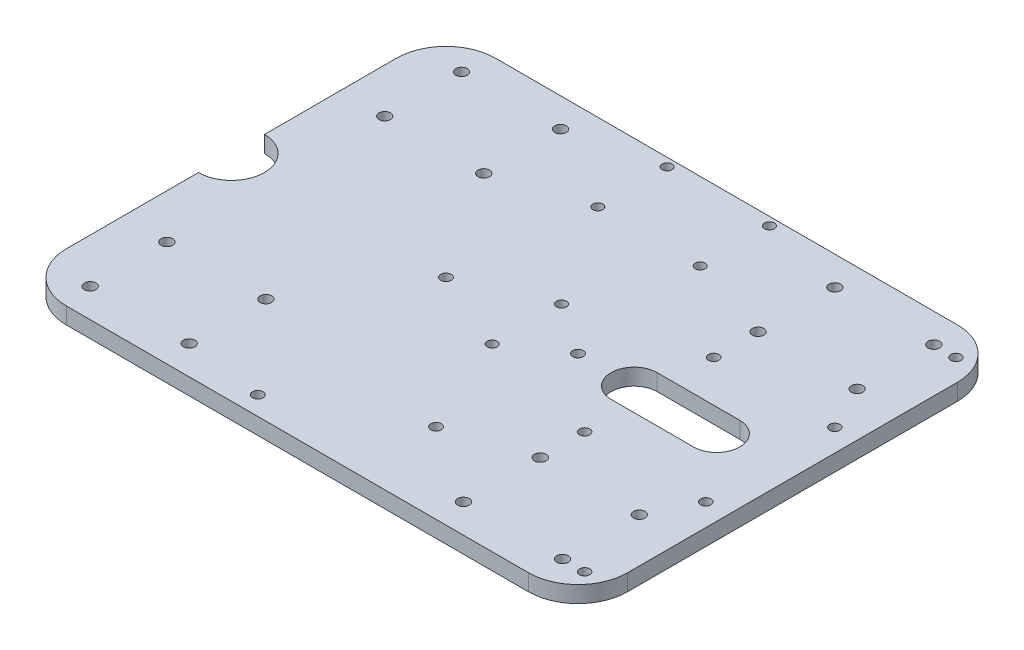
from build123d import *

# Parameters (mm, degrees)
SKETCH1_W           = 170
SKETCH1_H           = 130
BOSS_EXTRUDE1_DEPTH = 5
SKETCH3_R           = 1.75
CUT_EXTRUDE1_DEPTH  = 108.121426428
SKETCH4_R           = 1.55
SKETCH4_R_2         = 1.6
SKETCH4_R_3         = 1.5
CUT_EXTRUDE2_DEPTH  = 108.121426428
CUT_EXTRUDE3_DEPTH  = 108.121426428
CUT_EXTRUDE4_DEPTH  = 108.121426428
FILLET1_R           = 15
SKETCH7_R           = 1.6
CUT_EXTRUDE5_DEPTH  = 10


with BuildPart() as part:
    # Sketch1 → Boss-Extrude1 (new body)
    with BuildSketch(Plane(origin=(0, 0, 0), x_dir=(1, 0, 0), z_dir=(0, 1, 0))):
        Rectangle(SKETCH1_W, SKETCH1_H)
    extrude(amount=BOSS_EXTRUDE1_DEPTH)

    # Sketch3 → Cut-Extrude1 (cut, through all)
    with BuildSketch(Plane(origin=(0, 5, 0), x_dir=(1, 0, 0), z_dir=(0, 1, 0))):
        with Locations((41.55, 56.25)):
            Circle(SKETCH3_R)
        with Locations((71.55, 56.25)):
            Circle(SKETCH3_R)
        with Locations((71.55, 33)):
            Circle(SKETCH3_R)
        with Locations((41.55, 33)):
            Circle(SKETCH3_R)
        with Locations((41.55, -33)):
            Circle(SKETCH3_R)
        with Locations((71.55, -33)):
            Circle(SKETCH3_R)
        with Locations((71.55, -56.25)):
            Circle(SKETCH3_R)
        with Locations((41.55, -56.25)):
            Circle(SKETCH3_R)
        with Locations((-41.55, -56.25)):
            Circle(SKETCH3_R)
        with Locations((-71.55, -56.25)):
            Circle(SKETCH3_R)
        with Locations((-71.55, -33)):
            Circle(SKETCH3_R)
        with Locations((-41.55, -33)):
            Circle(SKETCH3_R)
        with Locations((-41.55, 33)):
            Circle(SKETCH3_R)
        with Locations((-71.55, 33)):
            Circle(SKETCH3_R)
        with Locations((-71.55, 56.25)):
            Circle(SKETCH3_R)
        with Locations((-41.55, 56.25)):
            Circle(SKETCH3_R)
    extrude(amount=-CUT_EXTRUDE1_DEPTH, mode=Mode.SUBTRACT)

    # Sketch4 → Cut-Extrude2 (cut, through all)
    with BuildSketch(Plane.XZ):
        with Locations((78.25, -19.55)):
            Circle(SKETCH4_R)
        with Locations((41.55, -19.55)):
            Circle(SKETCH4_R)
        with Locations((78.25, -56.25)):
            Circle(SKETCH4_R)
        with Locations((78.25, 56.25)):
            Circle(SKETCH4_R)
        with Locations((78.25, 19.55)):
            Circle(SKETCH4_R)
        with Locations((41.55, 19.55)):
            Circle(SKETCH4_R)
        with Locations((-17.7, 59.3)):
            Circle(SKETCH4_R_2)
        with Locations((17.7, 40.7)):
            Circle(SKETCH4_R_2)
        with Locations((4.5, 10.5)):
            Circle(SKETCH4_R_3)
        with Locations((4.5, -10.5)):
            Circle(SKETCH4_R_3)
        with Locations((15.5, -41.5)):
            Circle(SKETCH4_R_3)
        with Locations((15.5, -62.5)):
            Circle(SKETCH4_R_3)
        with Locations((-15.5, -41.5)):
            Circle(SKETCH4_R_3)
        with Locations((-15.5, -62.5)):
            Circle(SKETCH4_R_3)
    extrude(amount=-CUT_EXTRUDE2_DEPTH, mode=Mode.SUBTRACT)

    # Sketch5 → Cut-Extrude3 (cut, through all)
    with BuildSketch(Plane(origin=(0, 5, 0), x_dir=(1, 0, 0), z_dir=(0, 1, 0))):
        with BuildLine():
            Line((62, 7), (37, 7))
            ThreePointArc((37, 7), (30, 0), (37, -7))
            Line((37, -7), (62, -7))
            ThreePointArc((62, -7), (69, 0), (62, 7))
        make_face()
    extrude(amount=-CUT_EXTRUDE3_DEPTH, mode=Mode.SUBTRACT)

    # Sketch6 → Cut-Extrude4 (cut, through all)
    with BuildSketch(Plane(origin=(0, 5, 0), x_dir=(1, 0, 0), z_dir=(0, 1, 0))):
        with BuildLine():
            ThreePointArc((-75, 0), (-77.928932188, 7.071067812), (-85, 10))
            Line((-85, 10), (-85, -10))
            ThreePointArc((-85, -10), (-77.928932188, -7.071067812), (-75, 0))
        make_face()
    extrude(amount=-CUT_EXTRUDE4_DEPTH, mode=Mode.SUBTRACT)

    # Fillet1
    fillet1_edges = [part.edges().sort_by_distance(p)[0] for p in [
        (85, 2.5, -65),
        (85, 2.5, 65),
        (-85, 2.5, 65),
        (-85, 2.5, -65),
    ]]
    fillet(fillet1_edges, radius=FILLET1_R)

    # Sketch7 → Cut-Extrude5 (cut)
    with BuildSketch(Plane(origin=(0, 5, 0), x_dir=(1, 0, 0), z_dir=(0, 1, 0))):
        with Locations((20, 0)):
            Circle(SKETCH7_R)
        with Locations((-20, 0)):
            Circle(SKETCH7_R)
    extrude(amount=-CUT_EXTRUDE5_DEPTH, mode=Mode.SUBTRACT)


solid = part.part
